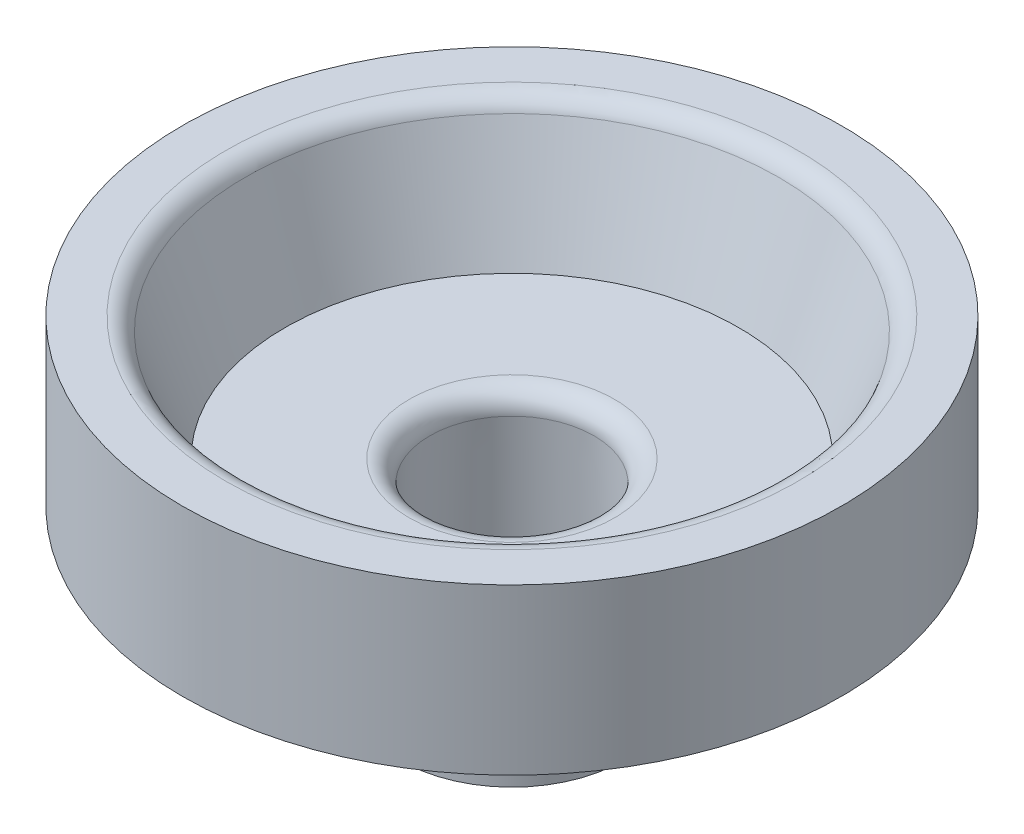
from build123d import *

# Parameters (mm, degrees)
SKETCH1_R           = 8
BOSS_EXTRUDE3_DEPTH = 4
SKETCH5_R           = 6.6
CUT_EXTRUDE2_DEPTH  = 3
CUT_EXTRUDE2_DRAFT  = -20
SKETCH6_R           = 2.7
BOSS_EXTRUDE4_DEPTH = 4
SKETCH7_R           = 2.15
CUT_EXTRUDE3_DEPTH  = 6
CUT_EXTRUDE3_DRAFT  = -2
FILLET1_R           = 0.5


with BuildPart() as part:
    # Sketch1 → Boss-Extrude3 (new body)
    with BuildSketch(Plane(origin=(0, 0, 0), x_dir=(1, 0, 0), z_dir=(0, 1, 0))):
        with Locations(Location((-48.414322475, 0, 0), (0, 0, 270))):
            Circle(SKETCH1_R)
    extrude(amount=BOSS_EXTRUDE3_DEPTH)


with BuildPart() as cut_extrude2_tool:
    # Sketch5 → Cut-Extrude2 (with draft: the straight prism first)
    with BuildSketch(Plane(origin=(0, 4, 0), x_dir=(1, 0, 0), z_dir=(0, 1, 0))):
        with Locations((-48.414322475, 0)):
            Circle(SKETCH5_R)
    extrude(amount=-CUT_EXTRUDE2_DEPTH)
    # Cut-Extrude2: the draft: its side faces are tilted about the plane it starts from
    cut_extrude2_sides = [cut_extrude2_tool.faces().sort_by_distance(p)[0] for p in [
        (-55.014322475, 2.5, 0),
    ]]
    draft(cut_extrude2_sides, Plane(origin=(0, 4, 0), x_dir=(1, 0, 0), z_dir=(0, 1, 0)), CUT_EXTRUDE2_DRAFT)


with BuildPart() as part_1:
    add(part.part)

    # Cut-Extrude2: cut by cut_extrude2_tool
    add(cut_extrude2_tool.part, mode=Mode.SUBTRACT)

    # Sketch6 → Boss-Extrude4 (add)
    with BuildSketch(Plane.XZ):
        with Locations(Location((-48.414322475, 0, 0), (0, 0, 270))):
            Circle(SKETCH6_R)
    extrude(amount=BOSS_EXTRUDE4_DEPTH)


with BuildPart() as cut_extrude3_tool:
    # Sketch7 → Cut-Extrude3 (with draft: the straight prism first)
    with BuildSketch(Plane.XZ.offset(4)):
        with Locations((-48.414322475, 0)):
            Circle(SKETCH7_R)
    extrude(amount=-CUT_EXTRUDE3_DEPTH)
    # Cut-Extrude3: the draft: its side faces are tilted about the plane it starts from
    cut_extrude3_sides = [cut_extrude3_tool.faces().sort_by_distance(p)[0] for p in [
        (-50.564322475, -1, 0),
    ]]
    draft(cut_extrude3_sides, Plane.XZ.offset(4), CUT_EXTRUDE3_DRAFT)


with BuildPart() as part_2:
    add(part_1.part)

    # Cut-Extrude3: cut by cut_extrude3_tool
    add(cut_extrude3_tool.part, mode=Mode.SUBTRACT)

    # Fillet1
    fillet1_edges = [part_2.edges().sort_by_distance(p)[0] for p in [
        (-50.389718627, 1, 0),
        (-50.564322475, -4, 0),
        (-55.014322475, 4, 0),
    ]]
    fillet(fillet1_edges, radius=FILLET1_R)


solid = part_2.part
